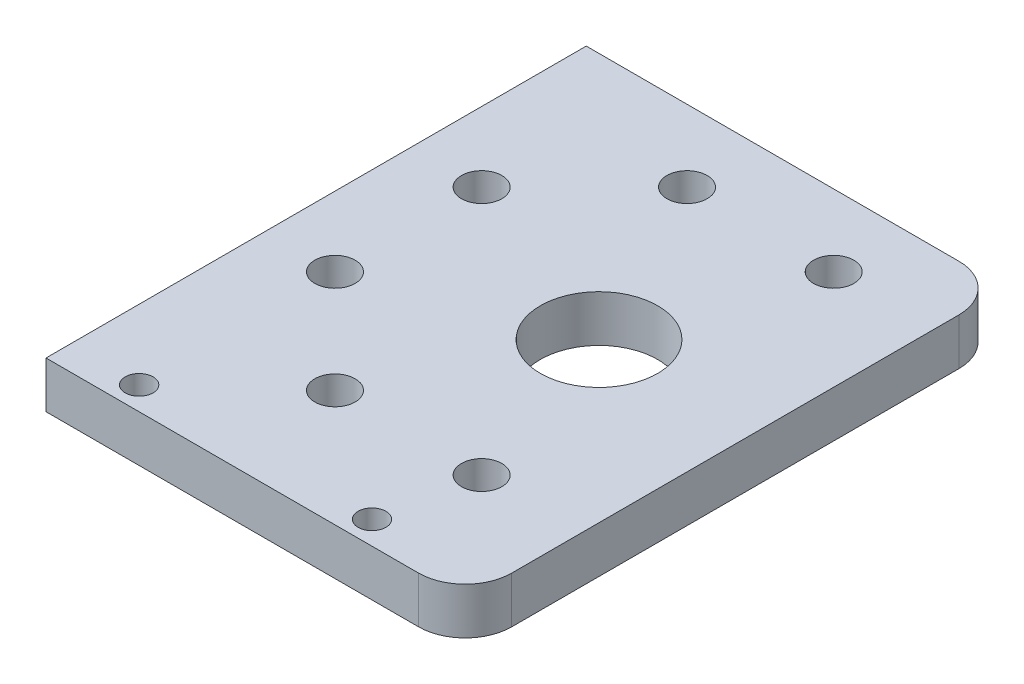
from build123d import *

# Parameters (mm, degrees)
SKETCH1_W                     = 57.15
SKETCH1_H                     = 73.66
BOSS_EXTRUDE1_DEPTH           = 6.35
F_6_CLEARANCE_HOLE1_D         = 3.7973
F_6_CLEARANCE_HOLE1_DEPTH     = 12.7
F_6_CLEARANCE_HOLE1_TIP       = 1.140824014
M5_CLEARANCE_HOLE1_D          = 5.5
M5_CLEARANCE_HOLE1_DEPTH      = 12.7
M5_CLEARANCE_HOLE1_TIP        = 1.652366702
SKETCH6_R                     = 8
CUT_EXTRUDE1_DEPTH            = 6.35
TAP_DRILL_FOR_6_32_TAP1_D     = 2.7051
TAP_DRILL_FOR_6_32_TAP1_DEPTH = 12.7
TAP_DRILL_FOR_6_32_TAP1_TIP   = 0.81269403
FILLET1_R                     = 6.35


with BuildPart() as part:
    # Sketch1 → Boss-Extrude1 (new body)
    with BuildSketch(Plane(origin=(0, 0, 0), x_dir=(1, 0, 0), z_dir=(0, 1, 0))):
        Rectangle(SKETCH1_W, SKETCH1_H)
    extrude(amount=BOSS_EXTRUDE1_DEPTH)

    # #6 Clearance Hole1
    with Locations(Plane(origin=(0, 6.35, 0), x_dir=(1, 0, 0), z_dir=(0, 1, 0))):
        with Locations((-19.05, -33.655), (12.7, -33.655)):
            Hole(F_6_CLEARANCE_HOLE1_D / 2, depth=F_6_CLEARANCE_HOLE1_DEPTH)
            with Locations((0, 0, -(F_6_CLEARANCE_HOLE1_DEPTH + F_6_CLEARANCE_HOLE1_TIP / 2))):  # 118° drill point
                Cone(0, F_6_CLEARANCE_HOLE1_D / 2, F_6_CLEARANCE_HOLE1_TIP, mode=Mode.SUBTRACT)

    # M5 Clearance Hole1
    with Locations(Plane(origin=(0, 6.35, 0), x_dir=(1, 0, 0), z_dir=(0, 1, 0))):
        with Locations((-19.05, 13.045000006), (-19.05, -6.954999994), (6.95, 3.045000006), (14.95, 27.045), (14.95, -20.955), (-5.05, 27.045), (-5.05, -20.955)):
            Hole(M5_CLEARANCE_HOLE1_D / 2, depth=M5_CLEARANCE_HOLE1_DEPTH)
            with Locations((0, 0, -(M5_CLEARANCE_HOLE1_DEPTH + M5_CLEARANCE_HOLE1_TIP / 2))):  # 118° drill point
                Cone(0, M5_CLEARANCE_HOLE1_D / 2, M5_CLEARANCE_HOLE1_TIP, mode=Mode.SUBTRACT)

    # Sketch6 → Cut-Extrude1 (cut)
    with BuildSketch(Plane(origin=(0, 6.35, 0), x_dir=(1, 0, 0), z_dir=(0, 1, 0))):
        with Locations(Location((6.95, 3.045000006, 0), (0, 0, 270))):
            Circle(SKETCH6_R)
    extrude(amount=-CUT_EXTRUDE1_DEPTH, mode=Mode.SUBTRACT)

    # Tap Drill for #6-32 Tap1
    with Locations(Plane.ZY.offset(28.575)):
        with Locations((26.67, 3.175), (-21.59, 3.175)):
            Hole(TAP_DRILL_FOR_6_32_TAP1_D / 2, depth=TAP_DRILL_FOR_6_32_TAP1_DEPTH)
            with Locations((0, 0, -(TAP_DRILL_FOR_6_32_TAP1_DEPTH + TAP_DRILL_FOR_6_32_TAP1_TIP / 2))):  # 118° drill point
                Cone(0, TAP_DRILL_FOR_6_32_TAP1_D / 2, TAP_DRILL_FOR_6_32_TAP1_TIP, mode=Mode.SUBTRACT)

    # Fillet1
    fillet1_edges = [part.edges().sort_by_distance(p)[0] for p in [
        (28.575, 3.175, -36.83),
        (28.575, 3.175, 36.83),
    ]]
    fillet(fillet1_edges, radius=FILLET1_R)


solid = part.part
